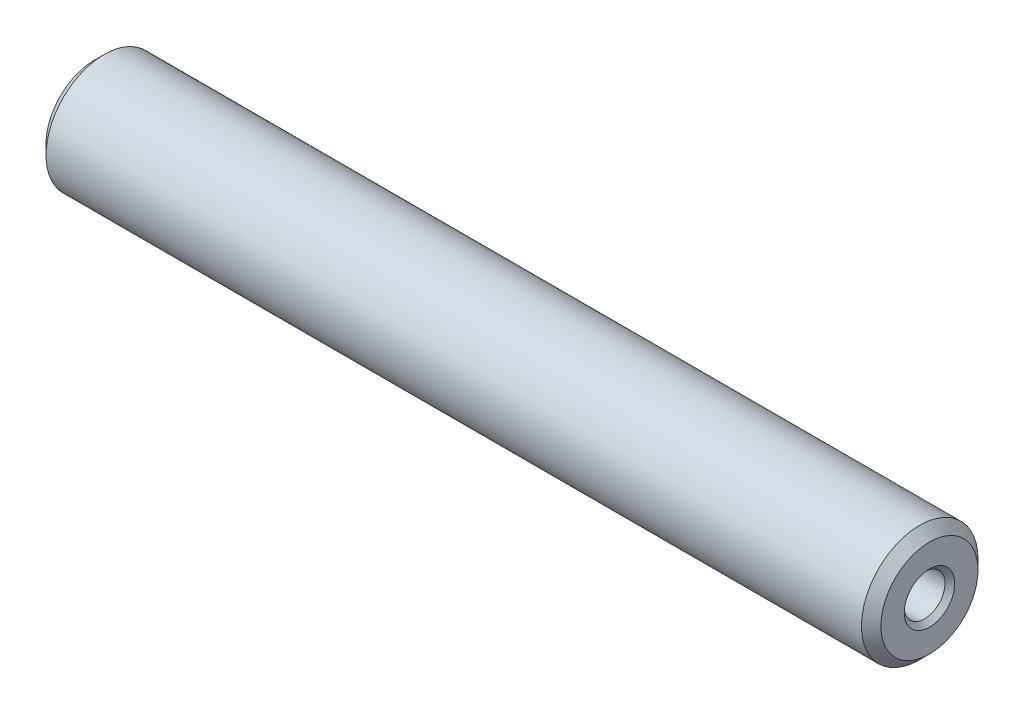
from build123d import *

# Parameters (mm, degrees)
SKETCH1_R             = 6
BOSS_EXTRUDE1_DEPTH   = 86
CHAMFER1_SIZE         = 1
M5_TAPPED_HOLE1_D     = 4.2
M5_TAPPED_HOLE1_DEPTH = 14
M5_TAPPED_HOLE1_TIP   = 1.2618073
CHAMFER2_SIZE         = 0.5
M5_TAPPED_HOLE2_D     = 4.2
M5_TAPPED_HOLE2_DEPTH = 14
M5_TAPPED_HOLE2_TIP   = 1.2618073
CHAMFER3_SIZE         = 0.5


with BuildPart() as part:
    # Sketch1 → Boss-Extrude1 (new body)
    with BuildSketch(Plane(origin=(0, 0, 0), x_dir=(0, 0, -1), z_dir=(1, 0, 0))):
        Circle(SKETCH1_R)
    extrude(amount=BOSS_EXTRUDE1_DEPTH)

    # Chamfer1
    chamfer1_edges = [part.edges().sort_by_distance(p)[0] for p in [
        (0, 0, 6),
        (86, 0, 6),
    ]]
    chamfer(chamfer1_edges, length=CHAMFER1_SIZE)

    # M5 Tapped Hole1
    with Locations(Plane(origin=(86, 0, 0), x_dir=(0, 0, -1), z_dir=(1, 0, 0))):
        with Locations((0, 0)):
            Hole(M5_TAPPED_HOLE1_D / 2, depth=M5_TAPPED_HOLE1_DEPTH)
            with Locations((0, 0, -(M5_TAPPED_HOLE1_DEPTH + M5_TAPPED_HOLE1_TIP / 2))):  # 118° drill point
                Cone(0, M5_TAPPED_HOLE1_D / 2, M5_TAPPED_HOLE1_TIP, mode=Mode.SUBTRACT)

    # Chamfer2
    chamfer2_edges = [part.edges().sort_by_distance(p)[0] for p in [
        (86, 0, -2.1),
    ]]
    chamfer(chamfer2_edges, length=CHAMFER2_SIZE)

    # M5 Tapped Hole2
    with Locations(Plane.ZY):
        with Locations((0, 0)):
            Hole(M5_TAPPED_HOLE2_D / 2, depth=M5_TAPPED_HOLE2_DEPTH)
            with Locations((0, 0, -(M5_TAPPED_HOLE2_DEPTH + M5_TAPPED_HOLE2_TIP / 2))):  # 118° drill point
                Cone(0, M5_TAPPED_HOLE2_D / 2, M5_TAPPED_HOLE2_TIP, mode=Mode.SUBTRACT)

    # Chamfer3
    chamfer3_edges = [part.edges().sort_by_distance(p)[0] for p in [
        (0, 0, 2.1),
    ]]
    chamfer(chamfer3_edges, length=CHAMFER3_SIZE)


solid = part.part
